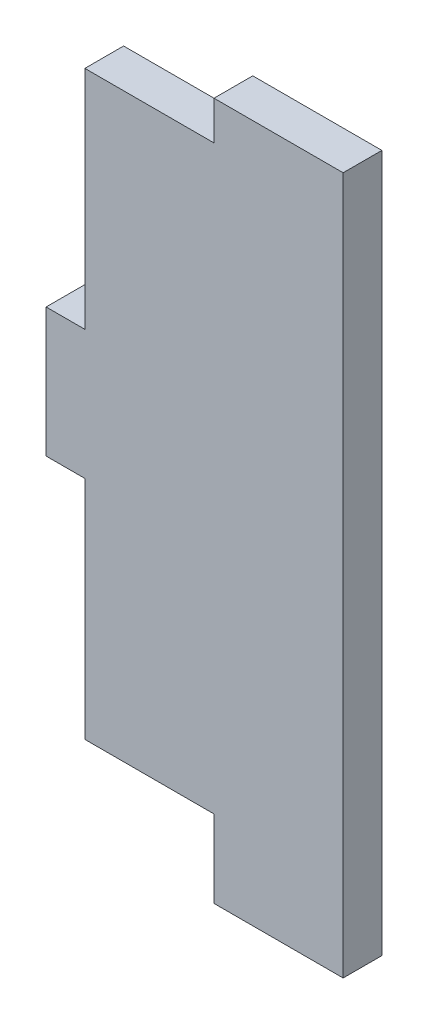
from build123d import *

# Parameters (mm, degrees)
BOSS_EXTRUDE1_DEPTH = 3


with BuildPart() as part:
    # Sketch1 → Boss-Extrude1 (new body)
    with BuildSketch(Plane.XY):
        Polygon((0, 0), (10, 0), (10, -6), (20, -6), (20, 48), (10, 48), (10, 45), (0, 45), (0, 27.5), (-3, 27.5), (-3, 17.5), (0, 17.5), align=None)
    extrude(amount=BOSS_EXTRUDE1_DEPTH)


solid = part.part
